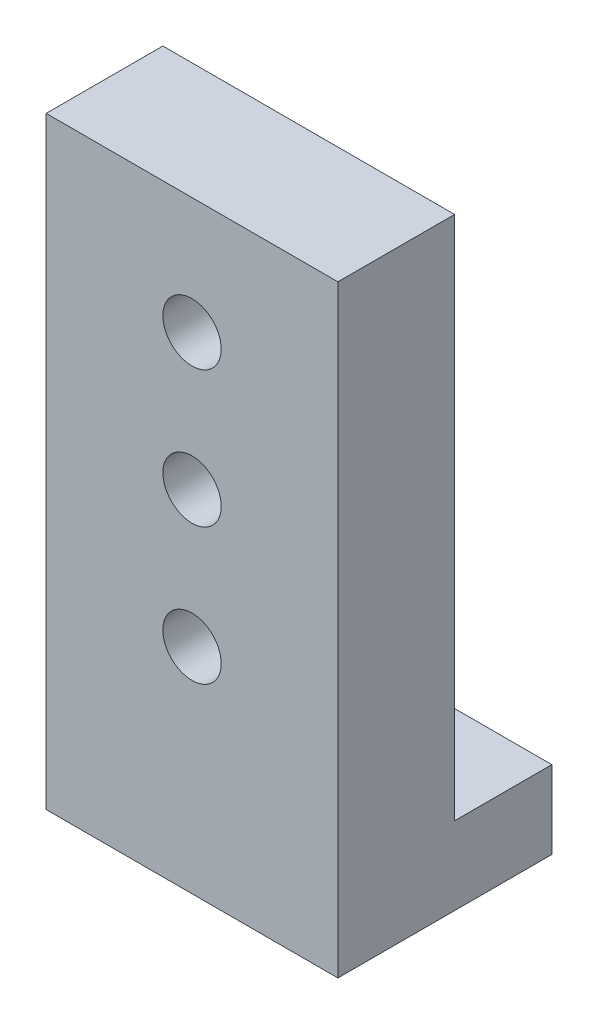
from build123d import *

# Parameters (mm, degrees)
SKETCH1_W           = 15
SKETCH1_H           = 31
BOSS_EXTRUDE1_DEPTH = 6
SKETCH2_R           = 1.5
CUT_EXTRUDE1_DEPTH  = 6
SKETCH3_W           = 15
SKETCH3_H           = 4
BOSS_EXTRUDE2_DEPTH = 5


with BuildPart() as part:
    # Sketch1 → Boss-Extrude1 (new body)
    with BuildSketch(Plane.XY):
        Rectangle(SKETCH1_W, SKETCH1_H)
    extrude(amount=BOSS_EXTRUDE1_DEPTH)

    # Sketch2 → Cut-Extrude1 (cut)
    with BuildSketch(Plane.XY.offset(6)):
        with Locations((0, 9.5)):
            Circle(SKETCH2_R)
        with Locations((0, 2.5)):
            Circle(SKETCH2_R)
        with Locations((0, -4.5)):
            Circle(SKETCH2_R)
    extrude(amount=-CUT_EXTRUDE1_DEPTH, mode=Mode.SUBTRACT)

    # Sketch3 → Boss-Extrude2 (add)
    with BuildSketch(Plane(origin=(0, 0, 0), x_dir=(-1, 0, 0), z_dir=(0, 0, -1))):
        with Locations((0, -13.5)):
            Rectangle(SKETCH3_W, SKETCH3_H)
    extrude(amount=BOSS_EXTRUDE2_DEPTH)


solid = part.part
